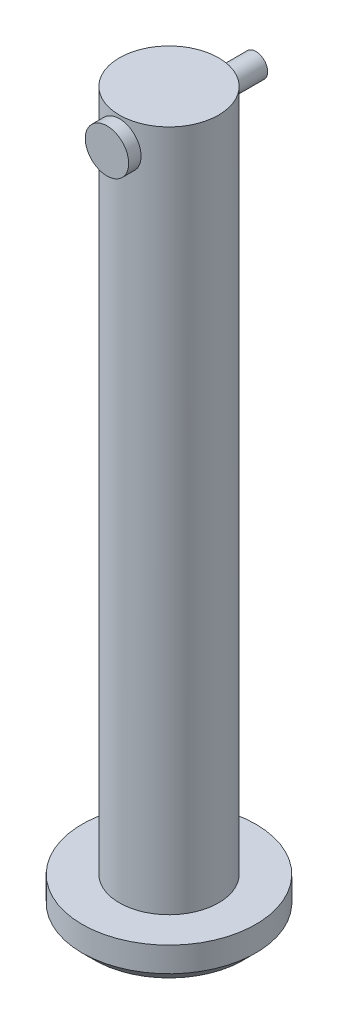
from build123d import *

# Parameters (mm, degrees)
SKETCH1_R                = 4
BOSS_EXTRUDE1_DEPTH      = 55
SKETCH2_R                = 7
BOSS_EXTRUDE2_DEPTH      = 3
CHAMFER1_SIZE            = 1
CUT_EXTRUDE1_DEPTH       = 10
CUT_EXTRUDE1_DEPTH_BACK  = 10
SKETCH3_R                = 1
BOSS_EXTRUDE3_DEPTH      = 5
BOSS_EXTRUDE3_DEPTH_BACK = 7
SKETCH4_R                = 0.95
SKETCH5_R                = 1.75
BOSS_EXTRUDE4_DEPTH      = 1


with BuildPart() as part:
    # Sketch1 → Boss-Extrude1 (new body)
    with BuildSketch(Plane(origin=(0, 0, 0), x_dir=(1, 0, 0), z_dir=(0, 1, 0))):
        Circle(SKETCH1_R)
    extrude(amount=BOSS_EXTRUDE1_DEPTH)

    # Sketch2 → Boss-Extrude2 (add)
    with BuildSketch(Plane.XZ):
        Circle(SKETCH2_R)
    extrude(amount=BOSS_EXTRUDE2_DEPTH)

    # Chamfer1
    chamfer1_edges = [part.edges().sort_by_distance(p)[0] for p in [
        (-7, -3, 0),
    ]]
    chamfer(chamfer1_edges, length=CHAMFER1_SIZE)

    # Sketch3 → Cut-Extrude1 (cut, two sides: drawn at the far end of the back side and taken through both)
    with BuildSketch(Plane.XY.offset(-CUT_EXTRUDE1_DEPTH_BACK)):
        with Locations((0, 53)):
            Circle(SKETCH3_R)
    extrude(amount=CUT_EXTRUDE1_DEPTH + CUT_EXTRUDE1_DEPTH_BACK, mode=Mode.SUBTRACT)


with BuildPart() as body_2:
    # Sketch4 → Boss-Extrude3 (new, two sides: drawn at the far end of the back side and taken through both)
    with BuildSketch(Plane.XY.offset(-BOSS_EXTRUDE3_DEPTH_BACK)):
        with Locations((0, 53)):
            Circle(SKETCH4_R)
    extrude(amount=BOSS_EXTRUDE3_DEPTH + BOSS_EXTRUDE3_DEPTH_BACK)

    # Sketch5 → Boss-Extrude4 (add)
    with BuildSketch(Plane.XY.offset(5)):
        with Locations((0, 53)):
            Circle(SKETCH5_R)
    extrude(amount=-BOSS_EXTRUDE4_DEPTH)


solid = Compound([part.part, body_2.part])
